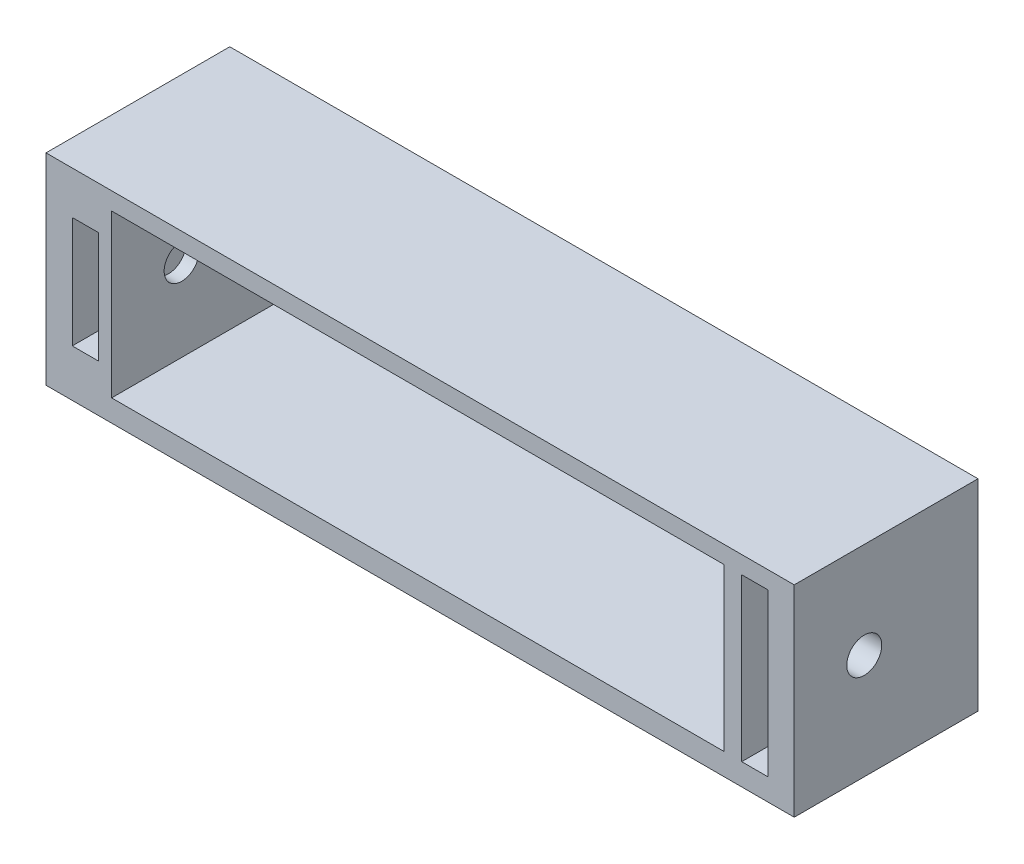
from build123d import *

# Parameters (mm, degrees)
SKETCH_1_W          = 85.5
SKETCH_1_H          = 23
SKETCH_1_W_2        = 3
SKETCH_1_H_2        = 18.5
SKETCH_1_W_3        = 70
SKETCH_1_H_3        = 12.711442786
EXTRUDE_1_DEPTH     = 19
SKETCH_2_W          = 85.5
SKETCH_2_H          = 23
EXTRUDE_2_DEPTH     = 2
SKETCH_3_R          = 2
CUT_EXTRUDE_1_DEPTH = 97


with BuildPart() as part:
    # 草圖1 → 填料-伸長1 (new body)
    with BuildSketch(Plane.XY):
        with Locations((-2.25, -0.25)):
            Rectangle(SKETCH_1_W, SKETCH_1_H)
        with Locations((36, 0)):
            Rectangle(SKETCH_1_W_2, SKETCH_1_H_2, mode=Mode.SUBTRACT)
        with Locations((-2.5, 0)):
            Rectangle(SKETCH_1_W_3, SKETCH_1_H_2, mode=Mode.SUBTRACT)
        with Locations((-40.5, 0)):
            Rectangle(SKETCH_1_W_2, SKETCH_1_H_3, mode=Mode.SUBTRACT)
    extrude(amount=EXTRUDE_1_DEPTH)

    # 草圖2 → 填料-伸長2 (add)
    with BuildSketch(Plane(origin=(0, 0, 0), x_dir=(-1, 0, 0), z_dir=(0, 0, -1))):
        with Locations((2.25, -0.25)):
            Rectangle(SKETCH_2_W, SKETCH_2_H)
    extrude(amount=EXTRUDE_2_DEPTH)

    # 草圖3 → 除料-伸長1 (cut)
    with BuildSketch(Plane(origin=(40.5, 0, 0), x_dir=(0, 0, -1), z_dir=(1, 0, 0))):
        with Locations(Location((-11, 0.282979523, 0), (0, 0, 90))):
            Circle(SKETCH_3_R)
    extrude(amount=-CUT_EXTRUDE_1_DEPTH, mode=Mode.SUBTRACT)


solid = part.part
